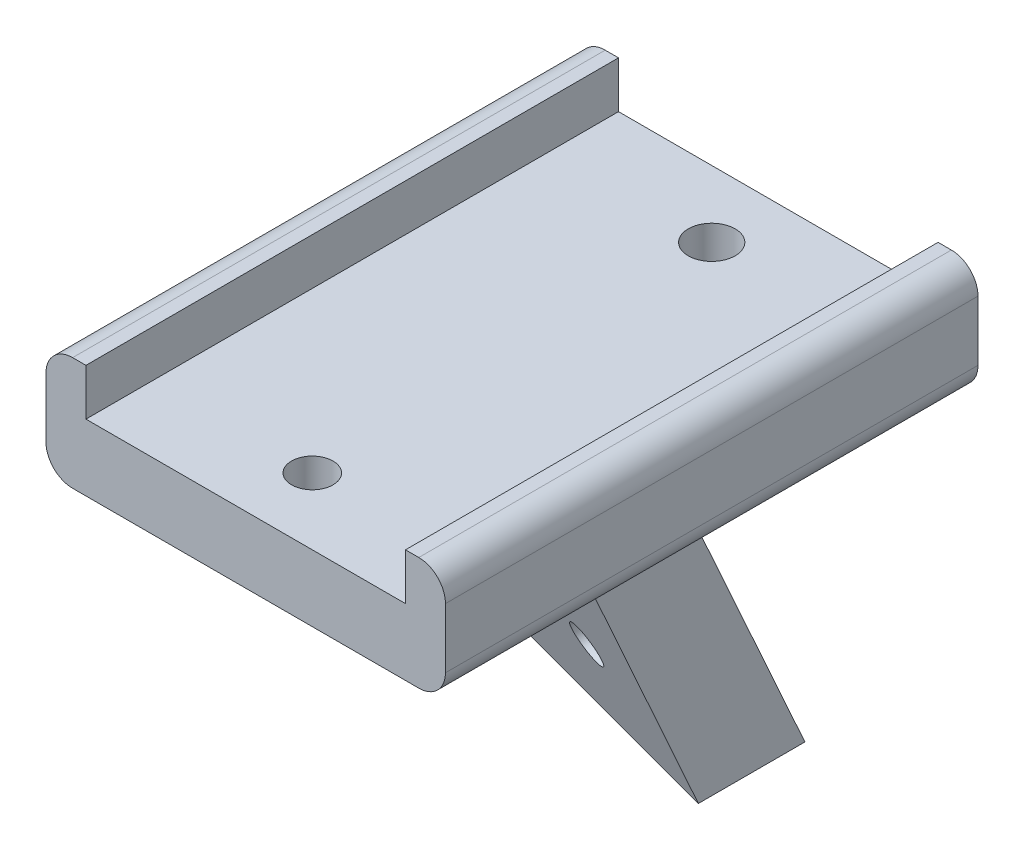
from build123d import *

# Parameters (mm, degrees)
SKETCH1_W           = 22
SKETCH1_H           = 40
SKETCH1_R           = 1.760631049
SKETCH1_R_2         = 1.555398854
BOSS_EXTRUDE1_DEPTH = 5
BOSS_EXTRUDE3_DEPTH = 40
FILLET1_R           = 2
SKETCH6_R           = 1.5
CUT_EXTRUDE1_DEPTH  = 7.086873748


with BuildPart() as part:
    # Sketch1 → Boss-Extrude1 (new body)
    with BuildSketch(Plane(origin=(0, 0, 0), x_dir=(1, 0, 0), z_dir=(0, 1, 0))):
        Rectangle(SKETCH1_W, SKETCH1_H)
        with Locations(Location((0, 15, 0), (0, 0, 270))):
            Circle(SKETCH1_R, mode=Mode.SUBTRACT)
        with Locations(Location((0, -15, 0), (0, 0, 270))):
            Circle(SKETCH1_R_2, mode=Mode.SUBTRACT)
    extrude(amount=BOSS_EXTRUDE1_DEPTH)

    # Sketch4 → Boss-Extrude3 (add)
    with BuildSketch(Plane(origin=(0, 0, -20), x_dir=(-1, 0, 0), z_dir=(0, 0, -1))):
        Polygon((-11, 5), (-12, 5), (-12, 8.5), (-15, 8.5), (-15, 0), (-11, 0), align=None)
        Polygon((11, 0), (11, 5), (12, 5), (12, 8.5), (15, 8.5), (15, 0), align=None)
    extrude(amount=-BOSS_EXTRUDE3_DEPTH)

    # Fillet1
    fillet1_edges = [part.edges().sort_by_distance(p)[0] for p in [
        (15, 0, 0),
        (15, 8.5, 0),
        (-15, 0, 0),
        (-15, 8.5, 0),
    ]]
    fillet(fillet1_edges, radius=FILLET1_R)

    # Sketch2 → Loft1 section 0
    with BuildSketch(Plane.XZ):
        with BuildLine():
            Line((-11, 0.105117767), (11, 6))
            Line((11, 6), (11, -2))
            Line((11, -2), (-11, -7.894882233))
            Line((-11, -7.894882233), (-11, 0.105117767))
        make_face()
    # Sketch5 → Loft1 section 1
    with BuildSketch(Plane(origin=(0, -20, 0), x_dir=(-1, 0, 0), z_dir=(0, -1, 0))):
        with BuildLine():
            Line((-11, 3), (-11, 11))
            Line((-11, 11), (11, 16.894882233))
            Line((11, 16.894882233), (11, 8.894882233))
            Line((11, 8.894882233), (-11, 3))
        make_face()
    loft()

    # Sketch6 → Cut-Extrude1 (cut)
    with BuildSketch(Plane(origin=(1.040309356, 1.747119317, -3.882487372), x_dir=(0.9714204714250083, -0.09740631922929449, 0.21645848717621435), z_dir=(-0.2373652621939752, -0.3986366483069059, 0.8858592184598079))):
        with Locations(Location((5.252708211, -11.411685947, 0), (0, 0, 90))):
            Circle(SKETCH6_R)
        with Locations(Location((-7.39453945, -12.762593713, 0), (0, 0, 90))):
            Circle(SKETCH6_R)
    extrude(amount=CUT_EXTRUDE1_DEPTH, mode=Mode.SUBTRACT)


solid = part.part
